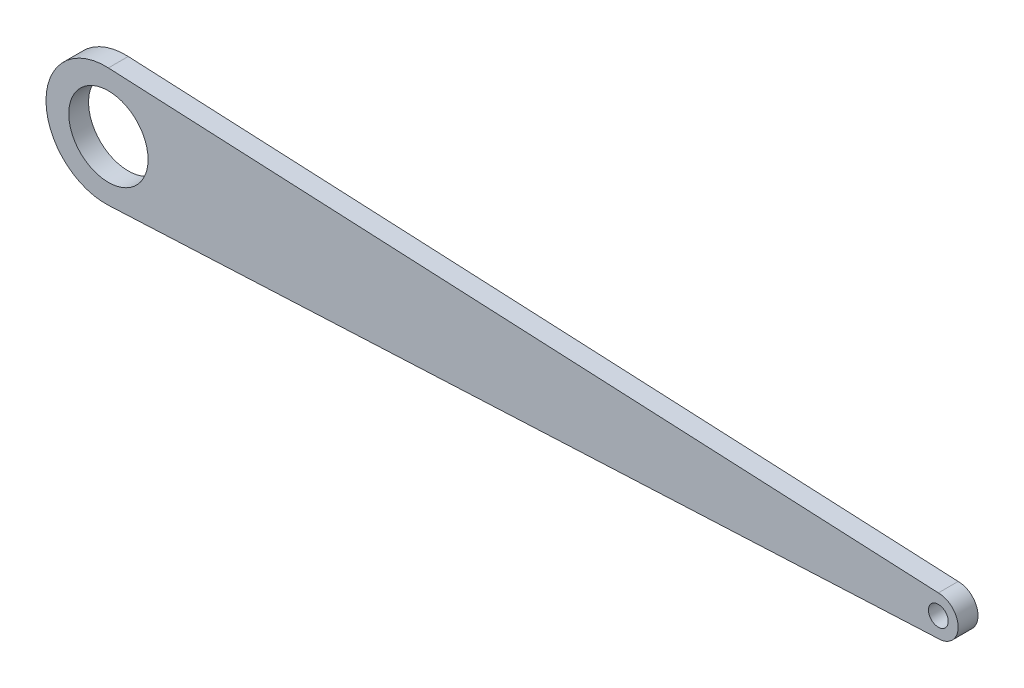
from build123d import *

# Parameters (mm, degrees)
ESBO_O1_R                = 10
ESBO_O1_R_2              = 2.5
RESSALTO_EXTRUS_O1_DEPTH = 5


with BuildPart() as part:
    # Esboço1 → Ressalto-extrusão1 (new body)
    with BuildSketch(Plane.XY):
        with BuildLine():
            Line((-104.635, -15), (104.635, -5))
            ThreePointArc((104.635, -5), (109.635, 0), (104.635, 5))
            Line((104.635, 5), (-104.635, 15))
            ThreePointArc((-104.635, 15), (-120.368893264, 0), (-104.635, -15))
        make_face()
        with Locations((-104.635, 0)):
            Circle(ESBO_O1_R, mode=Mode.SUBTRACT)
        with Locations((104.635, 0)):
            Circle(ESBO_O1_R_2, mode=Mode.SUBTRACT)
    extrude(amount=RESSALTO_EXTRUS_O1_DEPTH)


solid = part.part
